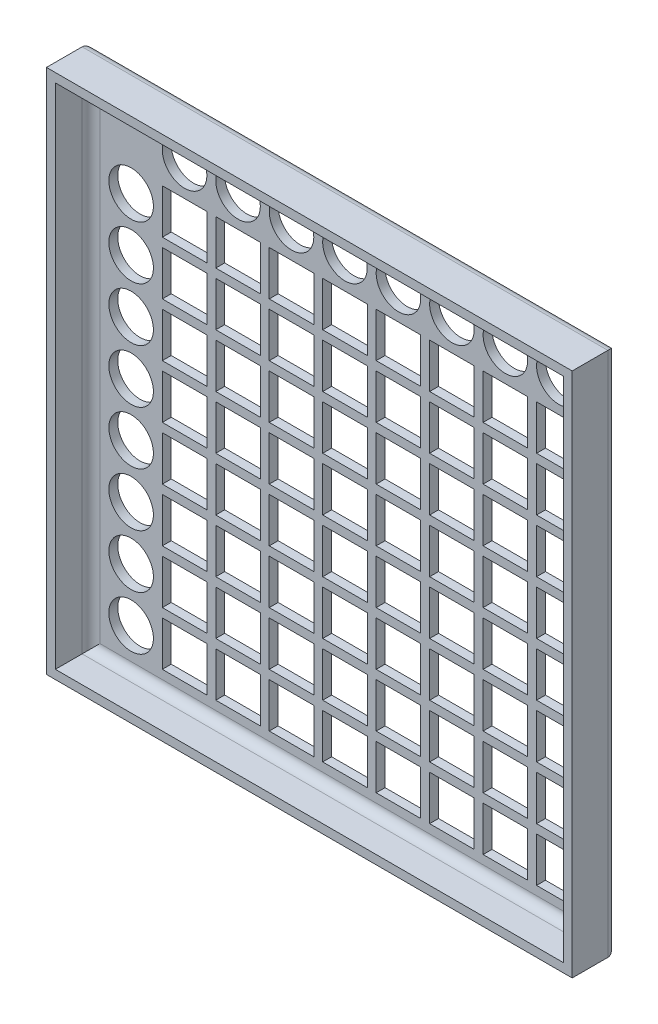
from build123d import *

# Parameters (mm, degrees)
SKETCH1_W           = 118
SKETCH1_H           = 118
SKETCH1_R           = 5
SKETCH1_W_2         = 10
SKETCH1_H_2         = 10
BOSS_EXTRUDE2_DEPTH = 10
SKETCH3_W           = 114
SKETCH3_H           = 114
CUT_EXTRUDE2_DEPTH  = 8
FILLET1_R           = 2
SKETCH4_W           = 0.628205128
SKETCH4_H           = 3.58974359
SKETCH4_W_2         = 0.628205129
CUT_EXTRUDE3_DEPTH  = 0.5


with BuildPart() as part:
    # Sketch1 → Boss-Extrude2 (new body)
    with BuildSketch(Plane.XY):
        with Locations((41, 53)):
            Rectangle(SKETCH1_W, SKETCH1_H)
        with Locations((89, 101)):
            Circle(SKETCH1_R, mode=Mode.SUBTRACT)
        with Locations((77, 101)):
            Circle(SKETCH1_R, mode=Mode.SUBTRACT)
        with Locations((65, 101)):
            Circle(SKETCH1_R, mode=Mode.SUBTRACT)
        with Locations((53, 101)):
            Circle(SKETCH1_R, mode=Mode.SUBTRACT)
        with Locations((41, 101)):
            Circle(SKETCH1_R, mode=Mode.SUBTRACT)
        with Locations((29, 101)):
            Circle(SKETCH1_R, mode=Mode.SUBTRACT)
        with Locations((17, 101)):
            Circle(SKETCH1_R, mode=Mode.SUBTRACT)
        with Locations((5, 101)):
            Circle(SKETCH1_R, mode=Mode.SUBTRACT)
        with Locations((-7, 5)):
            Circle(SKETCH1_R, mode=Mode.SUBTRACT)
        with Locations((-7, 17)):
            Circle(SKETCH1_R, mode=Mode.SUBTRACT)
        with Locations((-7, 29)):
            Circle(SKETCH1_R, mode=Mode.SUBTRACT)
        with Locations((-7, 41)):
            Circle(SKETCH1_R, mode=Mode.SUBTRACT)
        with Locations((-7, 53)):
            Circle(SKETCH1_R, mode=Mode.SUBTRACT)
        with Locations((-7, 65)):
            Circle(SKETCH1_R, mode=Mode.SUBTRACT)
        with Locations((-7, 77)):
            Circle(SKETCH1_R, mode=Mode.SUBTRACT)
        with Locations((-7, 89)):
            Circle(SKETCH1_R, mode=Mode.SUBTRACT)
        with Locations((17, 5)):
            Rectangle(SKETCH1_W_2, SKETCH1_H_2, mode=Mode.SUBTRACT)
        with Locations((5, 5)):
            Rectangle(SKETCH1_W_2, SKETCH1_H_2, mode=Mode.SUBTRACT)
        with Locations((29, 5)):
            Rectangle(SKETCH1_W_2, SKETCH1_H_2, mode=Mode.SUBTRACT)
        with Locations((41, 5)):
            Rectangle(SKETCH1_W_2, SKETCH1_H_2, mode=Mode.SUBTRACT)
        with Locations((53, 5)):
            Rectangle(SKETCH1_W_2, SKETCH1_H_2, mode=Mode.SUBTRACT)
        with Locations((65, 5)):
            Rectangle(SKETCH1_W_2, SKETCH1_H_2, mode=Mode.SUBTRACT)
        with Locations((77, 5)):
            Rectangle(SKETCH1_W_2, SKETCH1_H_2, mode=Mode.SUBTRACT)
        with Locations((89, 5)):
            Rectangle(SKETCH1_W_2, SKETCH1_H_2, mode=Mode.SUBTRACT)
        with Locations((17, 17)):
            Rectangle(SKETCH1_W_2, SKETCH1_H_2, mode=Mode.SUBTRACT)
        with Locations((29, 17)):
            Rectangle(SKETCH1_W_2, SKETCH1_H_2, mode=Mode.SUBTRACT)
        with Locations((41, 17)):
            Rectangle(SKETCH1_W_2, SKETCH1_H_2, mode=Mode.SUBTRACT)
        with Locations((53, 17)):
            Rectangle(SKETCH1_W_2, SKETCH1_H_2, mode=Mode.SUBTRACT)
        with Locations((65, 17)):
            Rectangle(SKETCH1_W_2, SKETCH1_H_2, mode=Mode.SUBTRACT)
        with Locations((77, 17)):
            Rectangle(SKETCH1_W_2, SKETCH1_H_2, mode=Mode.SUBTRACT)
        with Locations((89, 17)):
            Rectangle(SKETCH1_W_2, SKETCH1_H_2, mode=Mode.SUBTRACT)
        with Locations((17, 29)):
            Rectangle(SKETCH1_W_2, SKETCH1_H_2, mode=Mode.SUBTRACT)
        with Locations((29, 29)):
            Rectangle(SKETCH1_W_2, SKETCH1_H_2, mode=Mode.SUBTRACT)
        with Locations((41, 29)):
            Rectangle(SKETCH1_W_2, SKETCH1_H_2, mode=Mode.SUBTRACT)
        with Locations((53, 29)):
            Rectangle(SKETCH1_W_2, SKETCH1_H_2, mode=Mode.SUBTRACT)
        with Locations((65, 29)):
            Rectangle(SKETCH1_W_2, SKETCH1_H_2, mode=Mode.SUBTRACT)
        with Locations((77, 29)):
            Rectangle(SKETCH1_W_2, SKETCH1_H_2, mode=Mode.SUBTRACT)
        with Locations((89, 29)):
            Rectangle(SKETCH1_W_2, SKETCH1_H_2, mode=Mode.SUBTRACT)
        with Locations((17, 41)):
            Rectangle(SKETCH1_W_2, SKETCH1_H_2, mode=Mode.SUBTRACT)
        with Locations((29, 41)):
            Rectangle(SKETCH1_W_2, SKETCH1_H_2, mode=Mode.SUBTRACT)
        with Locations((41, 41)):
            Rectangle(SKETCH1_W_2, SKETCH1_H_2, mode=Mode.SUBTRACT)
        with Locations((53, 41)):
            Rectangle(SKETCH1_W_2, SKETCH1_H_2, mode=Mode.SUBTRACT)
        with Locations((65, 41)):
            Rectangle(SKETCH1_W_2, SKETCH1_H_2, mode=Mode.SUBTRACT)
        with Locations((77, 41)):
            Rectangle(SKETCH1_W_2, SKETCH1_H_2, mode=Mode.SUBTRACT)
        with Locations((89, 41)):
            Rectangle(SKETCH1_W_2, SKETCH1_H_2, mode=Mode.SUBTRACT)
        with Locations((17, 53)):
            Rectangle(SKETCH1_W_2, SKETCH1_H_2, mode=Mode.SUBTRACT)
        with Locations((29, 53)):
            Rectangle(SKETCH1_W_2, SKETCH1_H_2, mode=Mode.SUBTRACT)
        with Locations((41, 53)):
            Rectangle(SKETCH1_W_2, SKETCH1_H_2, mode=Mode.SUBTRACT)
        with Locations((53, 53)):
            Rectangle(SKETCH1_W_2, SKETCH1_H_2, mode=Mode.SUBTRACT)
        with Locations((65, 53)):
            Rectangle(SKETCH1_W_2, SKETCH1_H_2, mode=Mode.SUBTRACT)
        with Locations((77, 53)):
            Rectangle(SKETCH1_W_2, SKETCH1_H_2, mode=Mode.SUBTRACT)
        with Locations((89, 53)):
            Rectangle(SKETCH1_W_2, SKETCH1_H_2, mode=Mode.SUBTRACT)
        with Locations((17, 65)):
            Rectangle(SKETCH1_W_2, SKETCH1_H_2, mode=Mode.SUBTRACT)
        with Locations((29, 65)):
            Rectangle(SKETCH1_W_2, SKETCH1_H_2, mode=Mode.SUBTRACT)
        with Locations((41, 65)):
            Rectangle(SKETCH1_W_2, SKETCH1_H_2, mode=Mode.SUBTRACT)
        with Locations((53, 65)):
            Rectangle(SKETCH1_W_2, SKETCH1_H_2, mode=Mode.SUBTRACT)
        with Locations((65, 65)):
            Rectangle(SKETCH1_W_2, SKETCH1_H_2, mode=Mode.SUBTRACT)
        with Locations((77, 65)):
            Rectangle(SKETCH1_W_2, SKETCH1_H_2, mode=Mode.SUBTRACT)
        with Locations((89, 65)):
            Rectangle(SKETCH1_W_2, SKETCH1_H_2, mode=Mode.SUBTRACT)
        with Locations((17, 77)):
            Rectangle(SKETCH1_W_2, SKETCH1_H_2, mode=Mode.SUBTRACT)
        with Locations((29, 77)):
            Rectangle(SKETCH1_W_2, SKETCH1_H_2, mode=Mode.SUBTRACT)
        with Locations((41, 77)):
            Rectangle(SKETCH1_W_2, SKETCH1_H_2, mode=Mode.SUBTRACT)
        with Locations((53, 77)):
            Rectangle(SKETCH1_W_2, SKETCH1_H_2, mode=Mode.SUBTRACT)
        with Locations((65, 77)):
            Rectangle(SKETCH1_W_2, SKETCH1_H_2, mode=Mode.SUBTRACT)
        with Locations((77, 77)):
            Rectangle(SKETCH1_W_2, SKETCH1_H_2, mode=Mode.SUBTRACT)
        with Locations((89, 77)):
            Rectangle(SKETCH1_W_2, SKETCH1_H_2, mode=Mode.SUBTRACT)
        with Locations((17, 89)):
            Rectangle(SKETCH1_W_2, SKETCH1_H_2, mode=Mode.SUBTRACT)
        with Locations((29, 89)):
            Rectangle(SKETCH1_W_2, SKETCH1_H_2, mode=Mode.SUBTRACT)
        with Locations((41, 89)):
            Rectangle(SKETCH1_W_2, SKETCH1_H_2, mode=Mode.SUBTRACT)
        with Locations((53, 89)):
            Rectangle(SKETCH1_W_2, SKETCH1_H_2, mode=Mode.SUBTRACT)
        with Locations((65, 89)):
            Rectangle(SKETCH1_W_2, SKETCH1_H_2, mode=Mode.SUBTRACT)
        with Locations((77, 89)):
            Rectangle(SKETCH1_W_2, SKETCH1_H_2, mode=Mode.SUBTRACT)
        with Locations((89, 89)):
            Rectangle(SKETCH1_W_2, SKETCH1_H_2, mode=Mode.SUBTRACT)
        with Locations((5, 17)):
            Rectangle(SKETCH1_W_2, SKETCH1_H_2, mode=Mode.SUBTRACT)
        with Locations((5, 29)):
            Rectangle(SKETCH1_W_2, SKETCH1_H_2, mode=Mode.SUBTRACT)
        with Locations((5, 41)):
            Rectangle(SKETCH1_W_2, SKETCH1_H_2, mode=Mode.SUBTRACT)
        with Locations((5, 53)):
            Rectangle(SKETCH1_W_2, SKETCH1_H_2, mode=Mode.SUBTRACT)
        with Locations((5, 65)):
            Rectangle(SKETCH1_W_2, SKETCH1_H_2, mode=Mode.SUBTRACT)
        with Locations((5, 77)):
            Rectangle(SKETCH1_W_2, SKETCH1_H_2, mode=Mode.SUBTRACT)
        with Locations((5, 89)):
            Rectangle(SKETCH1_W_2, SKETCH1_H_2, mode=Mode.SUBTRACT)
    extrude(amount=BOSS_EXTRUDE2_DEPTH)

    # Sketch3 → Cut-Extrude2 (cut)
    with BuildSketch(Plane.XY.offset(10)):
        with Locations((41, 53)):
            Rectangle(SKETCH3_W, SKETCH3_H)
    extrude(amount=-CUT_EXTRUDE2_DEPTH, mode=Mode.SUBTRACT)

    # Fillet1
    fillet1_edges = [part.edges().sort_by_distance(p)[0] for p in [
        (-16, 53, 2),
        (41, 110, 2),
        (98, 53, 2),
        (41, -4, 2),
        (41, 112, 0),
        (100, 53, 0),
        (41, -6, 0),
        (-18, 53, 0),
    ]]
    fillet(fillet1_edges, radius=FILLET1_R)

    # Sketch4 → Cut-Extrude3 (cut, symmetric)
    # profile 1 of 8: a face of its own
    with BuildSketch(Plane(origin=(0, 0, 0), x_dir=(-1, 0, 0), z_dir=(0, 0, -1))):
        with BuildLine():
            Line((2.742105498, 107.626384613), (3.533672005, 107.626384613))
            add(Edge.make_bspline(
                [(3.533672005, 107.626384613), (3.595383718, 107.625953227), (3.714673159, 107.625119353), (3.887499959, 107.615723598), (4.04820689, 107.601273594), (4.196897547, 107.581394995), (4.333267091, 107.555090165), (4.457139676, 107.522095911), (4.568931047, 107.484009535), (4.669866974, 107.439193184), (4.762011767, 107.386941769), (4.849506189, 107.328737888), (4.932178447, 107.262449363), (5.011188714, 107.189355031), (5.085517347, 107.108117654), (5.156402184, 107.020082817), (5.222107641, 106.923973893), (5.284619854, 106.822095272), (5.341153833, 106.714015202), (5.390464881, 106.600653637), (5.431773045, 106.482740102), (5.465338068, 106.360148931), (5.492093265, 106.23328709), (5.510813337, 106.101898583), (5.522386272, 105.966105055), (5.523560249, 105.874071113), (5.52415678, 105.827306087)],
                knots=[0, 0, 0, 0, 1.44355588, 2.790409838, 4.047694926, 5.217575253, 6.298404546, 7.294384826, 8.214239204, 9.058592145, 9.873746385, 10.689560431, 11.514393297, 12.350027578, 13.205127629, 14.088021785, 14.991911688, 15.926770944, 16.882954281, 17.842803888, 18.816321264, 19.80318086, 20.814351908, 21.847355356, 22.906180909, 24, 24, 24, 24], degree=3))
            add(Edge.make_bspline(
                [(5.52415678, 105.827306087), (5.52259474, 105.761317592), (5.519519773, 105.631415376), (5.49361797, 105.44078537), (5.451725983, 105.258047497), (5.392822045, 105.084631202), (5.31979693, 104.922080784), (5.232560253, 104.77326275), (5.132391106, 104.638975881), (5.020456467, 104.519888814), (4.899258514, 104.417531867), (4.773309401, 104.329870632), (4.641382154, 104.260742434), (4.525135813, 104.216904818), (4.424335732, 104.189641614), (4.335834352, 104.173528798), (4.235305814, 104.158752374), (4.121812777, 104.147333471), (3.99585311, 104.137150616), (3.856924738, 104.131617649), (3.705477469, 104.127020575), (3.600283021, 104.126602155), (3.545591075, 104.126384613)],
                knots=[0, 0, 0, 0, 1.315458931, 2.589557908, 3.828601765, 5.048913369, 6.235739168, 7.376350998, 8.481830359, 9.569842114, 10.627874879, 11.640079404, 12.624025415, 13.590060155, 14.111227486, 14.704434459, 15.382649715, 16.137166398, 16.978595427, 17.902333227, 18.909396075, 20, 20, 20, 20], degree=3))
            Line((3.545591075, 104.126384613), (2.742105498, 104.126384613))
            Line((2.742105498, 104.126384613), (2.742105498, 107.626384613))
        make_face()
        with BuildLine():
            Line((3.370310626, 106.998179485), (3.370310626, 104.754589741))
            Line((3.370310626, 104.754589741), (3.698435626, 104.754589741))
            add(Edge.make_bspline(
                [(3.698435626, 104.754589741), (3.737477462, 104.754661282), (3.812567909, 104.754798879), (3.920981518, 104.761352733), (4.021236616, 104.767930994), (4.113057227, 104.780416756), (4.19711159, 104.794325015), (4.27224502, 104.813680262), (4.340006343, 104.834011309), (4.399567867, 104.859895252), (4.45412137, 104.889029353), (4.504631682, 104.92316333), (4.553388276, 104.961067823), (4.599479606, 105.003857659), (4.643080118, 105.05096622), (4.683931844, 105.102636234), (4.722580045, 105.158710055), (4.758032696, 105.219484159), (4.790429518, 105.284316759), (4.81916913, 105.352579855), (4.842998509, 105.424841933), (4.862804029, 105.500426532), (4.87695732, 105.579991703), (4.888666468, 105.662948116), (4.894702875, 105.749624439), (4.895531334, 105.808601905), (4.895951652, 105.838524036)],
                knots=[0, 0, 0, 0, 1.50275155, 2.890291501, 4.180787663, 5.369391935, 6.45668281, 7.458360028, 8.354766181, 9.177074746, 9.954075863, 10.732690366, 11.5210699, 12.329727389, 13.151100085, 13.990027547, 14.863562427, 15.770965086, 16.696477834, 17.652329173, 18.619756807, 19.62365428, 20.657822005, 21.729286259, 22.847956731, 24, 24, 24, 24], degree=3))
            add(Edge.make_bspline(
                [(4.895951652, 105.838524036), (4.895114522, 105.884376873), (4.893482184, 105.973786352), (4.877740264, 106.104013209), (4.852115423, 106.226641305), (4.815551243, 106.341215532), (4.769460962, 106.448057905), (4.71176823, 106.546263242), (4.644955922, 106.637481258), (4.592122571, 106.690992673), (4.565723287, 106.717730767)],
                knots=[0, 0, 0, 0, 1.13821349, 2.219428113, 3.251817212, 4.244760574, 5.201143372, 6.134805572, 7.068016741, 8, 8, 8, 8], degree=3))
            add(Edge.make_bspline(
                [(4.565723287, 106.717730767), (4.539691092, 106.740515237), (4.486523284, 106.787049938), (4.393178083, 106.84281041), (4.290316506, 106.89180145), (4.175585389, 106.930645881), (4.050093557, 106.961365714), (3.913093578, 106.982552431), (3.765319116, 106.996166791), (3.662944412, 106.997494213), (3.61009428, 106.998179485)],
                knots=[0, 0, 0, 0, 0.813307809, 1.661089106, 2.549956539, 3.493439533, 4.508053171, 5.589449661, 6.755572447, 8, 8, 8, 8], degree=3))
            Line((3.61009428, 106.998179485), (3.370310626, 106.998179485))
        make_face(mode=Mode.SUBTRACT)
    # profile 2 of 8: a face of its own
    with BuildSketch(Plane(origin=(0, 0, 0), x_dir=(-1, 0, 0), z_dir=(0, 0, -1))):
        with BuildLine():
            Line((7.992105498, 106.684076921), (8.620310626, 106.684076921))
            Line((8.620310626, 106.684076921), (8.620310626, 104.126384613))
            Line((8.620310626, 104.126384613), (7.992105498, 104.126384613))
            Line((7.992105498, 104.126384613), (7.992105498, 104.405431087))
            add(Edge.make_bspline(
                [(7.992105498, 104.405431087), (7.960978165, 104.378269002), (7.90056616, 104.325552757), (7.805376387, 104.257152089), (7.709908459, 104.200730378), (7.613703649, 104.155793562), (7.51528333, 104.122612349), (7.413938916, 104.098588376), (7.308210937, 104.084420851), (7.236338514, 104.08249226), (7.19983787, 104.081512818)],
                knots=[0, 0, 0, 0, 1.129196829, 2.191548051, 3.199897424, 4.157751732, 5.089409408, 6.034969131, 7.002052659, 8, 8, 8, 8], degree=3))
            add(Edge.make_bspline(
                [(7.19983787, 104.081512818), (7.158864274, 104.082434596), (7.077898126, 104.084256081), (6.959089292, 104.10343015), (6.844367551, 104.132780337), (6.733826026, 104.174314521), (6.627665837, 104.228134679), (6.525074535, 104.292836571), (6.427810849, 104.370691618), (6.335065092, 104.458331232), (6.250147634, 104.55473543), (6.17591199, 104.658566136), (6.113336859, 104.768350741), (6.062072403, 104.883725258), (6.021746288, 105.004605009), (5.992999538, 105.131373387), (5.976038923, 105.264075668), (5.973939676, 105.354467264), (5.972874729, 105.400322914)],
                knots=[0, 0, 0, 0, 0.980476535, 1.937477201, 2.874147792, 3.812856188, 4.758993464, 5.720109578, 6.712210464, 7.737600662, 8.772720504, 9.783789959, 10.789002326, 11.793715968, 12.802552247, 13.835794126, 14.902098527, 16, 16, 16, 16], degree=3))
            add(Edge.make_bspline(
                [(5.972874729, 105.400322914), (5.973992395, 105.4478065), (5.976184822, 105.540950845), (5.992222295, 105.677635742), (6.020438559, 105.807547331), (6.058913463, 105.930865559), (6.108404747, 106.047611732), (6.168681823, 106.157977115), (6.240564705, 106.261673233), (6.323396984, 106.356935103), (6.4128355, 106.444247208), (6.508518902, 106.52025932), (6.608950908, 106.584835146), (6.714238248, 106.63755408), (6.824365884, 106.678292604), (6.938899034, 106.708075792), (7.058346145, 106.72594675), (7.139714486, 106.72793975), (7.180907581, 106.728948716)],
                knots=[0, 0, 0, 0, 1.136281865, 2.228943489, 3.287578264, 4.313574083, 5.316051562, 6.317280042, 7.318008486, 8.329309503, 9.333984563, 10.305318864, 11.248632312, 12.186624717, 13.117503092, 14.05354244, 15.014596925, 16, 16, 16, 16], degree=3))
            add(Edge.make_bspline(
                [(7.180907581, 106.728948716), (7.219065736, 106.728155972), (7.294566968, 106.726587418), (7.405542902, 106.709555924), (7.513173552, 106.683797), (7.616871788, 106.647095168), (7.717488176, 106.60075164), (7.813292051, 106.542679744), (7.90637921, 106.475320218), (7.963177013, 106.422711), (7.992105498, 106.395915863)],
                knots=[0, 0, 0, 0, 1.017011718, 2.012299608, 2.98747302, 3.965332399, 4.941441765, 5.936729654, 6.94912688, 8, 8, 8, 8], degree=3))
            Line((7.992105498, 106.395915863), (7.992105498, 106.684076921))
        make_face()
        with BuildLine():
            add(Edge.make_bspline(
                [(7.312718479, 106.145615382), (7.287686356, 106.14484731), (7.238625031, 106.14334194), (7.166473637, 106.134287029), (7.097518549, 106.118331873), (7.03225155, 106.094761557), (6.96969992, 106.066049477), (6.910813517, 106.03008807), (6.855106333, 105.987582451), (6.802905987, 105.93956168), (6.755317681, 105.886778073), (6.714293784, 105.829179722), (6.679430099, 105.768318574), (6.649944482, 105.704011642), (6.62883947, 105.635497975), (6.61212431, 105.563669499), (6.603450223, 105.487939413), (6.601877885, 105.436331704), (6.601079857, 105.410138619)],
                knots=[0, 0, 0, 0, 1.04836806, 2.054732945, 3.03993516, 4.00574415, 4.955904794, 5.917688631, 6.888591924, 7.88601754, 8.884115178, 9.859153345, 10.841239365, 11.818093293, 12.814750328, 13.83810466, 14.90274714, 16, 16, 16, 16], degree=3))
            add(Edge.make_bspline(
                [(6.601079857, 105.410138619), (6.601865695, 105.383707949), (6.603414179, 105.331626618), (6.612264561, 105.255257722), (6.628378241, 105.182380001), (6.651887493, 105.113582623), (6.680597742, 105.047937283), (6.715544573, 104.98574694), (6.758470633, 104.928111197), (6.806100655, 104.8736662), (6.859371882, 104.825048931), (6.91539428, 104.781881259), (6.974933071, 104.745762896), (7.0373423, 104.716571807), (7.102411895, 104.692783522), (7.170957632, 104.67702889), (7.242308019, 104.666957252), (7.290949462, 104.665554711), (7.315522966, 104.664846151)],
                knots=[0, 0, 0, 0, 1.099136573, 2.165835871, 3.191374663, 4.196217796, 5.183857741, 6.167377911, 7.154730987, 8.166690795, 9.170734848, 10.148332609, 11.103258353, 12.059567475, 13.009337315, 13.978056681, 14.978520572, 16, 16, 16, 16], degree=3))
            add(Edge.make_bspline(
                [(7.315522966, 104.664846151), (7.341021341, 104.665618529), (7.391012018, 104.66713281), (7.464340525, 104.676105085), (7.534221927, 104.692118742), (7.600365479, 104.715824003), (7.663781462, 104.744329987), (7.723897603, 104.779588681), (7.780061552, 104.821996761), (7.832557753, 104.870451641), (7.880660402, 104.923666258), (7.922251627, 104.98201992), (7.958479106, 105.043646318), (7.986970351, 105.110002523), (8.009596396, 105.179927613), (8.025830061, 105.253855557), (8.034660233, 105.331866058), (8.036195174, 105.385111264), (8.036977293, 105.412241985)],
                knots=[0, 0, 0, 0, 1.050008698, 2.058587853, 3.036635738, 3.995319155, 4.947022481, 5.895997462, 6.858296291, 7.838991643, 8.833936038, 9.806048392, 10.784806122, 11.771666913, 12.772873988, 13.80724452, 14.882696879, 16, 16, 16, 16], degree=3))
            add(Edge.make_bspline(
                [(8.036977293, 105.412241985), (8.036204893, 105.43890607), (8.034696171, 105.490988773), (8.025791978, 105.567370451), (8.009443064, 105.639846788), (7.987282701, 105.708551003), (7.958284587, 105.773326006), (7.922029698, 105.833453596), (7.880894704, 105.891016968), (7.83225949, 105.942793963), (7.780047673, 105.990897993), (7.723057742, 106.032023622), (7.66308519, 106.06746683), (7.599761544, 106.096567071), (7.532500456, 106.117898651), (7.462499631, 106.134414913), (7.388666912, 106.143336505), (7.338447754, 106.14484336), (7.312718479, 106.145615382)],
                knots=[0, 0, 0, 0, 1.106611376, 2.161533483, 3.185006901, 4.184773755, 5.152708835, 6.122342771, 7.094156588, 8.082475533, 9.064254463, 10.03606828, 10.992420271, 11.951521816, 12.920622147, 13.915721683, 14.932141191, 16, 16, 16, 16], degree=3))
        make_face(mode=Mode.SUBTRACT)
    # profile 3 of 8: a face of its own
    with BuildSketch(Plane(origin=(0, 0, 0), x_dir=(-1, 0, 0), z_dir=(0, 0, -1))):
        with Locations((9.517746524, 105.921256408)):
            Rectangle(SKETCH4_W, SKETCH4_H)
    # profile 4 of 8: a face of its own
    with BuildSketch(Plane(origin=(0, 0, 0), x_dir=(-1, 0, 0), z_dir=(0, 0, -1))):
        with Locations((10.684413191, 105.921256408)):
            Rectangle(SKETCH4_W_2, SKETCH4_H)
    # profile 5 of 8: a face of its own
    with BuildSketch(Plane(origin=(0, 0, 0), x_dir=(-1, 0, 0), z_dir=(0, 0, -1))):
        with BuildLine():
            Line((14.13743803, 105.248179485), (12.120310626, 105.248179485))
            add(Edge.make_bspline(
                [(12.120310626, 105.248179485), (12.124423386, 105.224741609), (12.132505284, 105.178684333), (12.150055412, 105.111782144), (12.172452008, 105.04873465), (12.199292917, 104.989457572), (12.230125603, 104.933637536), (12.266089376, 104.881536359), (12.30672807, 104.833200061), (12.351806721, 104.788838716), (12.400573951, 104.74908999), (12.452793257, 104.714267593), (12.508518525, 104.685715358), (12.567110887, 104.661648786), (12.629008162, 104.642585623), (12.694301448, 104.629438122), (12.762817661, 104.621671846), (12.809492999, 104.620548542), (12.833351492, 104.619974357)],
                knots=[0, 0, 0, 0, 1.091296461, 2.144483647, 3.168565212, 4.157007626, 5.126487748, 6.090021542, 7.05641414, 8.019231907, 8.98705074, 9.938580405, 10.892824166, 11.854447369, 12.841318655, 13.858982407, 14.905600794, 16, 16, 16, 16], degree=3))
            add(Edge.make_bspline(
                [(12.833351492, 104.619974357), (12.862150312, 104.620734673), (12.91886367, 104.622231961), (13.001949162, 104.635510676), (13.082304936, 104.655567593), (13.159170542, 104.685393911), (13.233436349, 104.722522435), (13.303879713, 104.768780006), (13.371719953, 104.822814829), (13.413110494, 104.864464849), (13.43421287, 104.885699517)],
                knots=[0, 0, 0, 0, 1.021034703, 2.010718019, 2.977989445, 3.954245119, 4.929443971, 5.918328161, 6.938689359, 8, 8, 8, 8], degree=3))
            Line((13.43421287, 104.885699517), (13.960054216, 104.635399036))
            add(Edge.make_bspline(
                [(13.960054216, 104.635399036), (13.943498408, 104.612521451), (13.910693684, 104.567190356), (13.857141072, 104.503397799), (13.801255511, 104.443876754), (13.742995323, 104.389018703), (13.682286618, 104.338979967), (13.619298273, 104.293150985), (13.553109741, 104.252762247), (13.485044447, 104.21585977), (13.413695357, 104.184223448), (13.339259925, 104.157245109), (13.262053428, 104.13285692), (13.181100913, 104.114274456), (13.097076471, 104.099564729), (13.009779101, 104.089118874), (12.919220306, 104.08266697), (12.857668021, 104.081902105), (12.826340274, 104.081512818)],
                knots=[0, 0, 0, 0, 1.028154879, 2.037251081, 3.030720504, 4.000128189, 4.949298328, 5.894184978, 6.834267904, 7.770992897, 8.712077017, 9.673380525, 10.653304757, 11.658697181, 12.695551717, 13.758623199, 14.859225354, 16, 16, 16, 16], degree=3))
            add(Edge.make_bspline(
                [(12.826340274, 104.081512818), (12.778143049, 104.082495415), (12.683751562, 104.084419773), (12.545686948, 104.102280573), (12.414563859, 104.131895706), (12.290012049, 104.17215293), (12.172569913, 104.225305077), (12.062179328, 104.290314562), (11.957737336, 104.365935023), (11.862435222, 104.453753533), (11.775612184, 104.54933876), (11.699352226, 104.651990766), (11.635538979, 104.760992361), (11.583134258, 104.87562215), (11.542403487, 104.996173539), (11.513038965, 105.122699135), (11.49503816, 105.255138507), (11.493093984, 105.345344504), (11.492105498, 105.391208331)],
                knots=[0, 0, 0, 0, 1.103565453, 2.161269334, 3.182010356, 4.179077853, 5.15417608, 6.128274628, 7.109042802, 8.101804412, 9.090965879, 10.063106201, 11.02526161, 11.978650795, 12.945248442, 13.93468508, 14.949922959, 16, 16, 16, 16], degree=3))
            add(Edge.make_bspline(
                [(11.492105498, 105.391208331), (11.493103713, 105.438237617), (11.495067656, 105.530765624), (11.512883978, 105.666263082), (11.54248467, 105.795545984), (11.583334587, 105.918792365), (11.634944323, 106.036387689), (11.699569484, 106.147303136), (11.775574341, 106.251924854), (11.8620846, 106.349763412), (11.957790443, 106.438073399), (12.059486944, 106.516775246), (12.168316766, 106.582354849), (12.283048951, 106.635343128), (12.40294963, 106.678394766), (12.529404688, 106.707042036), (12.661451994, 106.726276963), (12.751716624, 106.72804838), (12.79759428, 106.728948716)],
                knots=[0, 0, 0, 0, 1.079208495, 2.12329425, 3.130605359, 4.119693003, 5.099659317, 6.073216462, 7.060498243, 8.06384408, 9.066070512, 10.045757761, 11.010926815, 11.975797609, 12.942977511, 13.929384301, 14.947594487, 16, 16, 16, 16], degree=3))
            add(Edge.make_bspline(
                [(12.79759428, 106.728948716), (12.846022403, 106.727950875), (12.94110603, 106.725991718), (13.080132221, 106.708275943), (13.212125951, 106.678480221), (13.337649588, 106.638571094), (13.455100144, 106.584076267), (13.567058364, 106.520666563), (13.670838854, 106.443411508), (13.767547804, 106.356022754), (13.854847395, 106.25906796), (13.931156912, 106.153745358), (13.996086918, 106.041082836), (14.048713333, 105.920623523), (14.08940228, 105.792729049), (14.118793985, 105.657565511), (14.136657486, 105.514618811), (14.138565485, 105.416735012), (14.139541396, 105.366669068)],
                knots=[0, 0, 0, 0, 1.080001299, 2.120471247, 3.119684163, 4.095710327, 5.052285597, 6.002875087, 6.961153713, 7.931888285, 8.906493152, 9.865905668, 10.82813294, 11.801621613, 12.7925306, 13.817193356, 14.883530496, 16, 16, 16, 16], degree=3))
            Line((14.139541396, 105.366669068), (14.13743803, 105.248179485))
        make_face()
        with BuildLine():
            add(Edge.make_bspline(
                [(13.511336267, 105.741769228), (13.499481652, 105.773760032), (13.47591159, 105.837366084), (13.422667799, 105.925126915), (13.352014992, 106.001131359), (13.269840709, 106.068418696), (13.175951446, 106.123033302), (13.073305816, 106.16257605), (12.963201242, 106.186286378), (12.887455229, 106.189067183), (12.848776171, 106.190487177)],
                knots=[0, 0, 0, 0, 0.954238005, 1.897273737, 2.851915805, 3.847685534, 4.862635127, 5.880135777, 6.917509367, 8, 8, 8, 8], degree=3))
            add(Edge.make_bspline(
                [(12.848776171, 106.190487177), (12.806532343, 106.1891231), (12.723954454, 106.186456612), (12.604841473, 106.158097539), (12.492485178, 106.11577247), (12.426246274, 106.072134424), (12.393047005, 106.050262818)],
                knots=[0, 0, 0, 0, 1.044195649, 2.041185066, 3.018232172, 4, 4, 4, 4], degree=3))
            add(Edge.make_bspline(
                [(12.393047005, 106.050262818), (12.37233314, 106.033604924), (12.32817224, 105.998091144), (12.270820351, 105.927244526), (12.214328264, 105.841465176), (12.182209398, 105.776309699), (12.165182421, 105.741769228)],
                knots=[0, 0, 0, 0, 0.82159062, 1.751589201, 2.808063854, 4, 4, 4, 4], degree=3))
            Line((12.165182421, 105.741769228), (13.511336267, 105.741769228))
        make_face(mode=Mode.SUBTRACT)
    # profile 6 of 8: a face of its own
    with BuildSketch(Plane(origin=(0, 0, 0), x_dir=(-1, 0, 0), z_dir=(0, 0, -1))):
        with BuildLine():
            Line((4.088259344, 100.927666664), (4.789381139, 100.927666664))
            add(Edge.make_bspline(
                [(4.789381139, 100.927666664), (4.835191528, 100.927461607), (4.92356937, 100.927066009), (5.051017489, 100.922268857), (5.168594619, 100.913672068), (5.276273747, 100.903047796), (5.374010598, 100.88815298), (5.461927567, 100.87107724), (5.5400429, 100.850274018), (5.609237463, 100.825580883), (5.671337348, 100.796468641), (5.730103869, 100.765462025), (5.784208895, 100.728456723), (5.83638327, 100.689441009), (5.883644096, 100.644687726), (5.928939786, 100.597175271), (5.970351943, 100.545019338), (6.008072457, 100.488851261), (6.042290775, 100.429708786), (6.072186187, 100.367486184), (6.096435671, 100.302084994), (6.116777973, 100.233928288), (6.133117108, 100.163019035), (6.143992956, 100.088921138), (6.15138038, 100.012151976), (6.152032218, 99.959902836), (6.152361908, 99.933475959)],
                knots=[0, 0, 0, 0, 1.698747864, 3.27724071, 4.728299578, 6.070144658, 7.288476769, 8.393259625, 9.389771311, 10.283485332, 11.113357557, 11.931608583, 12.74405601, 13.541433047, 14.344816069, 15.154114104, 15.974336324, 16.810834471, 17.661136416, 18.50621059, 19.367396281, 20.244825668, 21.142564693, 22.063065223, 23.020325768, 24, 24, 24, 24], degree=3))
            add(Edge.make_bspline(
                [(6.152361908, 99.933475959), (6.151884888, 99.904240535), (6.150947483, 99.846789334), (6.141757897, 99.762572921), (6.12605918, 99.682280196), (6.105541778, 99.605234037), (6.07693172, 99.532702022), (6.044246073, 99.462953517), (6.004032359, 99.397944055), (5.958081762, 99.336860446), (5.907898468, 99.279206051), (5.852291128, 99.226645533), (5.792319641, 99.178820587), (5.728331161, 99.135230005), (5.660085455, 99.095961718), (5.587631768, 99.060648021), (5.510475343, 99.030418356), (5.45674593, 99.014608486), (5.429505338, 99.006592946)],
                knots=[0, 0, 0, 0, 1.102006807, 2.165578795, 3.188629044, 4.184801286, 5.166646146, 6.124351954, 7.085497154, 8.042432466, 9.003981491, 9.963833307, 10.922997304, 11.89326795, 12.880200226, 13.889073926, 14.929769137, 16, 16, 16, 16], degree=3))
            add(Edge.make_bspline(
                [(5.429505338, 99.006592946), (5.411563117, 99.002128893), (5.372694489, 98.992458315), (5.308377585, 98.982640252), (5.234259106, 98.973613146), (5.150099379, 98.965855441), (5.055849883, 98.96058201), (4.951601877, 98.956463694), (4.837308117, 98.953469254), (4.757832756, 98.953362998), (4.716464472, 98.95330769)],
                knots=[0, 0, 0, 0, 0.618981996, 1.340914327, 2.176866532, 3.120127938, 4.170906482, 5.338178032, 6.614476169, 8, 8, 8, 8], degree=3))
            Line((4.716464472, 98.95330769), (4.716464472, 97.427666664))
            Line((4.716464472, 97.427666664), (4.088259344, 97.427666664))
            Line((4.088259344, 97.427666664), (4.088259344, 100.927666664))
        make_face()
        with BuildLine():
            Line((4.716464472, 99.581512818), (4.938720081, 99.581512818))
            add(Edge.make_bspline(
                [(4.938720081, 99.581512818), (4.979162998, 99.581769258), (5.053578566, 99.58224111), (5.155203954, 99.589064371), (5.23687207, 99.599484869), (5.301391398, 99.614430272), (5.352335519, 99.637111901), (5.396271634, 99.663350274), (5.433956761, 99.696527976), (5.466586534, 99.734439178), (5.492673055, 99.77800105), (5.510762698, 99.82650427), (5.522513375, 99.878929734), (5.523598659, 99.915414387), (5.52415678, 99.934177081)],
                knots=[0, 0, 0, 0, 1.8619151, 3.425951444, 4.686033666, 5.651700536, 6.461346321, 7.243864085, 7.999046032, 8.762387399, 9.539336099, 10.322741239, 11.137448474, 12, 12, 12, 12], degree=3))
            add(Edge.make_bspline(
                [(5.52415678, 99.934177081), (5.5236044, 99.950569803), (5.52253265, 99.982375624), (5.514659282, 100.028279313), (5.502111398, 100.071071021), (5.483929997, 100.110303844), (5.46042575, 100.145911121), (5.431769317, 100.177878824), (5.398328415, 100.206891568), (5.372510084, 100.222248457), (5.359393158, 100.230050478)],
                knots=[0, 0, 0, 0, 1.102301479, 2.1387299, 3.123554645, 4.094223062, 5.036071848, 5.982632524, 6.975082478, 8, 8, 8, 8], degree=3))
            add(Edge.make_bspline(
                [(5.359393158, 100.230050478), (5.348282365, 100.235669525), (5.324758538, 100.247566199), (5.284695181, 100.261396952), (5.238462678, 100.273064716), (5.185748908, 100.282748847), (5.126764163, 100.290264739), (5.061518964, 100.296012515), (4.989917299, 100.29832392), (4.940122625, 100.299071872), (4.914180819, 100.299461536)],
                knots=[0, 0, 0, 0, 0.656809284, 1.390599849, 2.23162475, 3.173112763, 4.218524733, 5.370385145, 6.63003504, 8, 8, 8, 8], degree=3))
            Line((4.914180819, 100.299461536), (4.716464472, 100.299461536))
            Line((4.716464472, 100.299461536), (4.716464472, 99.581512818))
        make_face(mode=Mode.SUBTRACT)
    # profile 7 of 8: a face of its own
    with BuildSketch(Plane(origin=(0, 0, 0), x_dir=(-1, 0, 0), z_dir=(0, 0, -1))):
        with BuildLine():
            Line((8.620310626, 99.985358972), (9.248515755, 99.985358972))
            Line((9.248515755, 99.985358972), (9.248515755, 97.427666664))
            Line((9.248515755, 97.427666664), (8.620310626, 97.427666664))
            Line((8.620310626, 97.427666664), (8.620310626, 97.706713139))
            add(Edge.make_bspline(
                [(8.620310626, 97.706713139), (8.589183294, 97.679551053), (8.528771288, 97.626834808), (8.433581515, 97.55843414), (8.338113587, 97.502012429), (8.241908777, 97.457075614), (8.143488459, 97.4238944), (8.042144044, 97.399870427), (7.936416066, 97.385702902), (7.864543643, 97.383774311), (7.828042998, 97.382794869)],
                knots=[0, 0, 0, 0, 1.129196829, 2.191548051, 3.199897424, 4.157751732, 5.089409408, 6.034969131, 7.002052659, 8, 8, 8, 8], degree=3))
            add(Edge.make_bspline(
                [(7.828042998, 97.382794869), (7.787069402, 97.383716647), (7.706103254, 97.385538132), (7.58729442, 97.404712202), (7.47257268, 97.434062389), (7.362031154, 97.475596572), (7.255870965, 97.529416731), (7.153279663, 97.594118622), (7.056015978, 97.671973669), (6.963270221, 97.759613283), (6.878352762, 97.856017481), (6.804117118, 97.959848188), (6.741541987, 98.069632793), (6.690277531, 98.18500731), (6.649951416, 98.30588706), (6.621204666, 98.432655438), (6.604244051, 98.565357719), (6.602144805, 98.655749316), (6.601079857, 98.701604966)],
                knots=[0, 0, 0, 0, 0.980476535, 1.937477201, 2.874147792, 3.812856188, 4.758993464, 5.720109578, 6.712210464, 7.737600662, 8.772720504, 9.783789959, 10.789002326, 11.793715968, 12.802552247, 13.835794126, 14.902098527, 16, 16, 16, 16], degree=3))
            add(Edge.make_bspline(
                [(6.601079857, 98.701604966), (6.602197523, 98.749088551), (6.604389951, 98.842232896), (6.620427424, 98.978917793), (6.648643688, 99.108829382), (6.687118592, 99.232147611), (6.736609875, 99.348893783), (6.796886951, 99.459259167), (6.868769833, 99.562955284), (6.951602112, 99.658217154), (7.041040628, 99.74552926), (7.13672403, 99.821541372), (7.237156037, 99.886117198), (7.342443376, 99.938836131), (7.452571012, 99.979574655), (7.567104162, 100.009357843), (7.686551274, 100.027228802), (7.767919614, 100.029221801), (7.80911271, 100.030230767)],
                knots=[0, 0, 0, 0, 1.136281865, 2.228943489, 3.287578264, 4.313574083, 5.316051562, 6.317280042, 7.318008486, 8.329309503, 9.333984563, 10.305318864, 11.248632312, 12.186624717, 13.117503092, 14.05354244, 15.014596925, 16, 16, 16, 16], degree=3))
            add(Edge.make_bspline(
                [(7.80911271, 100.030230767), (7.847270864, 100.029438023), (7.922772097, 100.027869469), (8.033748031, 100.010837976), (8.14137868, 99.985079051), (8.245076916, 99.94837722), (8.345693304, 99.902033691), (8.441497179, 99.843961796), (8.534584338, 99.776602269), (8.591382142, 99.723993052), (8.620310626, 99.697197914)],
                knots=[0, 0, 0, 0, 1.017011718, 2.012299608, 2.98747302, 3.965332399, 4.941441765, 5.936729654, 6.94912688, 8, 8, 8, 8], degree=3))
            Line((8.620310626, 99.697197914), (8.620310626, 99.985358972))
        make_face()
        with BuildLine():
            add(Edge.make_bspline(
                [(7.940923607, 99.446897434), (7.915891485, 99.446129362), (7.866830159, 99.444623991), (7.794678765, 99.43556908), (7.725723678, 99.419613924), (7.660456678, 99.396043608), (7.597905048, 99.367331528), (7.539018645, 99.331370121), (7.483311461, 99.288864502), (7.431111115, 99.240843731), (7.383522809, 99.188060124), (7.342498912, 99.130461773), (7.307635227, 99.069600625), (7.27814961, 99.005293693), (7.257044598, 98.936780026), (7.240329438, 98.86495155), (7.231655352, 98.789221465), (7.230083013, 98.737613755), (7.229284985, 98.711420671)],
                knots=[0, 0, 0, 0, 1.04836806, 2.054732945, 3.03993516, 4.00574415, 4.955904794, 5.917688631, 6.888591924, 7.88601754, 8.884115178, 9.859153345, 10.841239365, 11.818093293, 12.814750328, 13.83810466, 14.90274714, 16, 16, 16, 16], degree=3))
            add(Edge.make_bspline(
                [(7.229284985, 98.711420671), (7.230070823, 98.68499), (7.231619307, 98.63290867), (7.240469689, 98.556539773), (7.256583369, 98.483662053), (7.280092621, 98.414864674), (7.308802871, 98.349219334), (7.343749701, 98.287028991), (7.386675761, 98.229393249), (7.434305783, 98.174948252), (7.487577011, 98.126330982), (7.543599409, 98.083163311), (7.603138199, 98.047044948), (7.665547428, 98.017853858), (7.730617023, 97.994065574), (7.79916276, 97.978310942), (7.870513147, 97.968239303), (7.91915459, 97.966836762), (7.943728094, 97.966128203)],
                knots=[0, 0, 0, 0, 1.099136573, 2.165835871, 3.191374663, 4.196217796, 5.183857741, 6.167377911, 7.154730987, 8.166690795, 9.170734848, 10.148332609, 11.103258353, 12.059567475, 13.009337315, 13.978056681, 14.978520572, 16, 16, 16, 16], degree=3))
            add(Edge.make_bspline(
                [(7.943728094, 97.966128203), (7.969226469, 97.966900581), (8.019217146, 97.968414861), (8.092545653, 97.977387136), (8.162427055, 97.993400793), (8.228570607, 98.017106055), (8.29198659, 98.045612039), (8.352102732, 98.080870732), (8.40826668, 98.123278813), (8.460762881, 98.171733693), (8.50886553, 98.224948309), (8.550456755, 98.283301972), (8.586684234, 98.344928369), (8.61517548, 98.411284575), (8.637801524, 98.481209664), (8.654035189, 98.555137608), (8.662865361, 98.633148109), (8.664400303, 98.686393316), (8.665182421, 98.713524036)],
                knots=[0, 0, 0, 0, 1.050008698, 2.058587853, 3.036635738, 3.995319155, 4.947022481, 5.895997462, 6.858296291, 7.838991643, 8.833936038, 9.806048392, 10.784806122, 11.771666913, 12.772873988, 13.80724452, 14.882696879, 16, 16, 16, 16], degree=3))
            add(Edge.make_bspline(
                [(8.665182421, 98.713524036), (8.664410021, 98.740188121), (8.6629013, 98.792270824), (8.653997107, 98.868652503), (8.637648192, 98.941128839), (8.615487829, 99.009833055), (8.586489715, 99.074608057), (8.550234826, 99.134735647), (8.509099832, 99.192299019), (8.460464618, 99.244076015), (8.408252801, 99.292180044), (8.35126287, 99.333305673), (8.291290318, 99.368748882), (8.227966672, 99.397849123), (8.160705584, 99.419180702), (8.090704759, 99.435696964), (8.016872041, 99.444618556), (7.966652882, 99.446125412), (7.940923607, 99.446897434)],
                knots=[0, 0, 0, 0, 1.106611376, 2.161533483, 3.185006901, 4.184773755, 5.152708835, 6.122342771, 7.094156588, 8.082475533, 9.064254463, 10.03606828, 10.992420271, 11.951521816, 12.920622147, 13.915721683, 14.932141191, 16, 16, 16, 16], degree=3))
        make_face(mode=Mode.SUBTRACT)
    # profile 8 of 8: a face of its own
    with BuildSketch(Plane(origin=(0, 0, 0), x_dir=(-1, 0, 0), z_dir=(0, 0, -1))):
        with BuildLine():
            Line((11.806208062, 101.017410254), (12.43441319, 101.017410254))
            Line((12.43441319, 101.017410254), (12.43441319, 97.427666664))
            Line((12.43441319, 97.427666664), (11.806208062, 97.427666664))
            Line((11.806208062, 97.427666664), (11.806208062, 97.706713139))
            add(Edge.make_bspline(
                [(11.806208062, 97.706713139), (11.77508073, 97.679551053), (11.714668724, 97.626834808), (11.619478951, 97.55843414), (11.524011023, 97.502012429), (11.427806213, 97.457075614), (11.329385895, 97.4238944), (11.22804148, 97.399870427), (11.122313502, 97.385702902), (11.050441079, 97.383774311), (11.013940434, 97.382794869)],
                knots=[0, 0, 0, 0, 1.129196829, 2.191548051, 3.199897424, 4.157751732, 5.089409408, 6.034969131, 7.002052659, 8, 8, 8, 8], degree=3))
            add(Edge.make_bspline(
                [(11.013940434, 97.382794869), (10.972966838, 97.383716647), (10.89200069, 97.385538132), (10.773191856, 97.404712202), (10.658470116, 97.434062389), (10.54792859, 97.475596572), (10.441768401, 97.529416731), (10.339177099, 97.594118622), (10.241913414, 97.671973669), (10.149167657, 97.759613283), (10.064250198, 97.856017481), (9.990014554, 97.959848188), (9.927439423, 98.069632793), (9.876174967, 98.18500731), (9.835848852, 98.30588706), (9.807102102, 98.432655438), (9.790141487, 98.565357719), (9.78804224, 98.655749316), (9.786977293, 98.701604966)],
                knots=[0, 0, 0, 0, 0.980476535, 1.937477201, 2.874147792, 3.812856188, 4.758993464, 5.720109578, 6.712210464, 7.737600662, 8.772720504, 9.783789959, 10.789002326, 11.793715968, 12.802552247, 13.835794126, 14.902098527, 16, 16, 16, 16], degree=3))
            add(Edge.make_bspline(
                [(9.786977293, 98.701604966), (9.788094959, 98.749088551), (9.790287386, 98.842232896), (9.80632486, 98.978917793), (9.834541124, 99.108829382), (9.873016028, 99.232147611), (9.922507311, 99.348893783), (9.982784387, 99.459259167), (10.054667269, 99.562955284), (10.137499548, 99.658217154), (10.226938064, 99.74552926), (10.322621466, 99.821541372), (10.423053473, 99.886117198), (10.528340812, 99.938836131), (10.638468448, 99.979574655), (10.753001598, 100.009357843), (10.872448709, 100.027228802), (10.95381705, 100.029221801), (10.995010146, 100.030230767)],
                knots=[0, 0, 0, 0, 1.136281865, 2.228943489, 3.287578264, 4.313574083, 5.316051562, 6.317280042, 7.318008486, 8.329309503, 9.333984563, 10.305318864, 11.248632312, 12.186624717, 13.117503092, 14.05354244, 15.014596925, 16, 16, 16, 16], degree=3))
            add(Edge.make_bspline(
                [(10.995010146, 100.030230767), (11.0331437, 100.02902091), (11.108552804, 100.026628418), (11.219945042, 100.011568279), (11.327125529, 99.98321135), (11.431395971, 99.946675531), (11.531402215, 99.897510782), (11.62768155, 99.838452148), (11.720487656, 99.7687496), (11.777273366, 99.714847556), (11.806208062, 99.687382209)],
                knots=[0, 0, 0, 0, 1.011899165, 2.001030639, 2.974036179, 3.948778736, 4.92769327, 5.924124564, 6.942254589, 8, 8, 8, 8], degree=3))
            Line((11.806208062, 99.687382209), (11.806208062, 101.017410254))
        make_face()
        with BuildLine():
            add(Edge.make_bspline(
                [(11.126821043, 99.446897434), (11.10178892, 99.446129362), (11.052727595, 99.444623991), (10.980576201, 99.43556908), (10.911621113, 99.419613924), (10.846354114, 99.396043608), (10.783802484, 99.367331528), (10.724916081, 99.331370121), (10.669208897, 99.288864502), (10.617008551, 99.240843731), (10.569420245, 99.188060124), (10.528396348, 99.130461773), (10.493532663, 99.069600625), (10.464047046, 99.005293693), (10.442942034, 98.936780026), (10.426226874, 98.86495155), (10.417552787, 98.789221465), (10.415980449, 98.737613755), (10.415182421, 98.711420671)],
                knots=[0, 0, 0, 0, 1.04836806, 2.054732945, 3.03993516, 4.00574415, 4.955904794, 5.917688631, 6.888591924, 7.88601754, 8.884115178, 9.859153345, 10.841239365, 11.818093293, 12.814750328, 13.83810466, 14.90274714, 16, 16, 16, 16], degree=3))
            add(Edge.make_bspline(
                [(10.415182421, 98.711420671), (10.415968259, 98.68499), (10.417516743, 98.63290867), (10.426367125, 98.556539773), (10.442480805, 98.483662053), (10.465990057, 98.414864674), (10.494700307, 98.349219334), (10.529647137, 98.287028991), (10.572573197, 98.229393249), (10.620203219, 98.174948252), (10.673474446, 98.126330982), (10.729496845, 98.083163311), (10.789035635, 98.047044948), (10.851444864, 98.017853858), (10.916514459, 97.994065574), (10.985060196, 97.978310942), (11.056410583, 97.968239303), (11.105052026, 97.966836762), (11.12962553, 97.966128203)],
                knots=[0, 0, 0, 0, 1.099136573, 2.165835871, 3.191374663, 4.196217796, 5.183857741, 6.167377911, 7.154730987, 8.166690795, 9.170734848, 10.148332609, 11.103258353, 12.059567475, 13.009337315, 13.978056681, 14.978520572, 16, 16, 16, 16], degree=3))
            add(Edge.make_bspline(
                [(11.12962553, 97.966128203), (11.155123905, 97.966900581), (11.205114582, 97.968414861), (11.278443089, 97.977387136), (11.348324491, 97.993400793), (11.414468043, 98.017106055), (11.477884026, 98.045612039), (11.538000168, 98.080870732), (11.594164116, 98.123278813), (11.646660317, 98.171733693), (11.694762966, 98.224948309), (11.736354191, 98.283301972), (11.77258167, 98.344928369), (11.801072915, 98.411284575), (11.82369896, 98.481209664), (11.839932625, 98.555137608), (11.848762797, 98.633148109), (11.850297739, 98.686393316), (11.851079857, 98.713524036)],
                knots=[0, 0, 0, 0, 1.050008698, 2.058587853, 3.036635738, 3.995319155, 4.947022481, 5.895997462, 6.858296291, 7.838991643, 8.833936038, 9.806048392, 10.784806122, 11.771666913, 12.772873988, 13.80724452, 14.882696879, 16, 16, 16, 16], degree=3))
            add(Edge.make_bspline(
                [(11.851079857, 98.713524036), (11.850307457, 98.740188121), (11.848798736, 98.792270824), (11.839894542, 98.868652503), (11.823545628, 98.941128839), (11.801385265, 99.009833055), (11.772387151, 99.074608057), (11.736132262, 99.134735647), (11.694997268, 99.192299019), (11.646362054, 99.244076015), (11.594150237, 99.292180044), (11.537160306, 99.333305673), (11.477187754, 99.368748882), (11.413864108, 99.397849123), (11.34660302, 99.419180702), (11.276602195, 99.435696964), (11.202769476, 99.444618556), (11.152550318, 99.446125412), (11.126821043, 99.446897434)],
                knots=[0, 0, 0, 0, 1.106611376, 2.161533483, 3.185006901, 4.184773755, 5.152708835, 6.122342771, 7.094156588, 8.082475533, 9.064254463, 10.03606828, 10.992420271, 11.951521816, 12.920622147, 13.915721683, 14.932141191, 16, 16, 16, 16], degree=3))
        make_face(mode=Mode.SUBTRACT)
    extrude(amount=CUT_EXTRUDE3_DEPTH, both=True, mode=Mode.SUBTRACT)


solid = part.part
